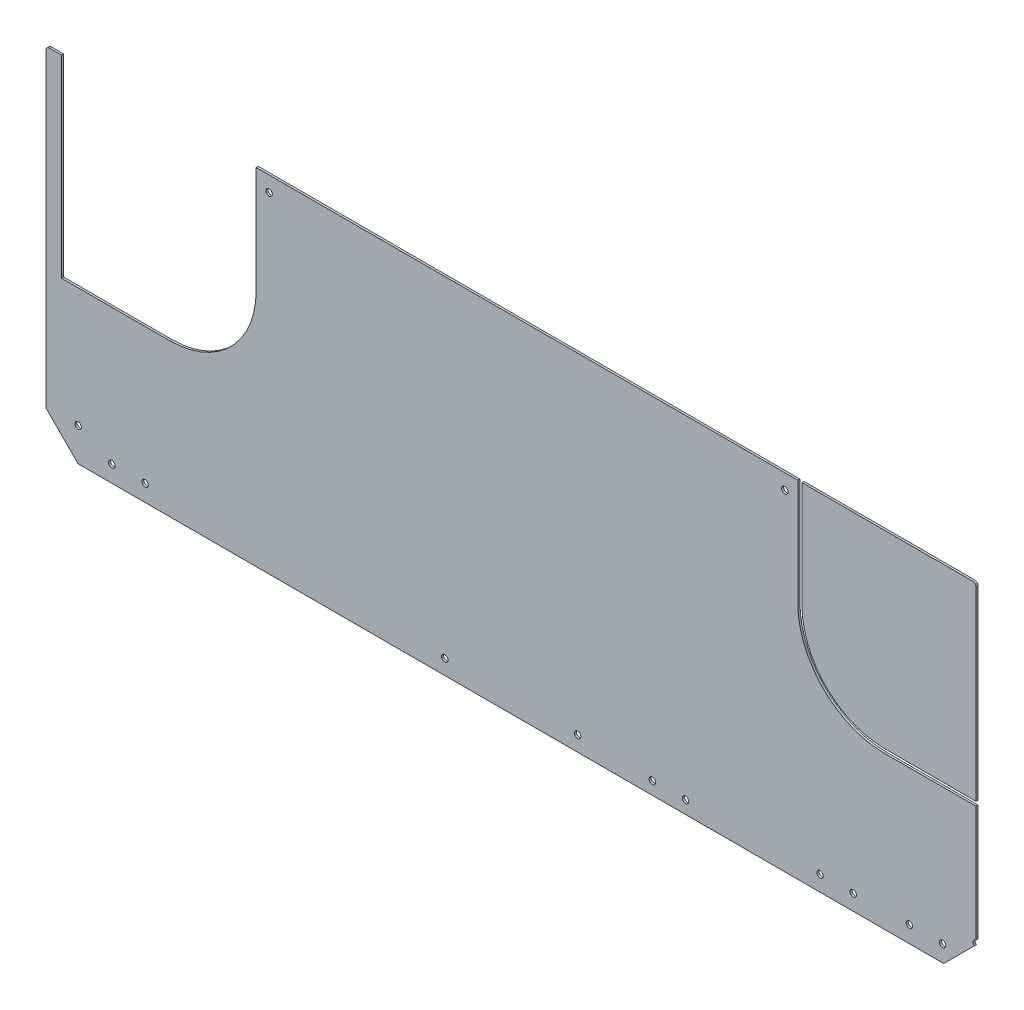
from build123d import *

# Parameters (mm, degrees)
SKETCH3_W                              = 914.4
SKETCH3_H                              = 609.6
BOSS_EXTRUDE1_DEPTH                    = 0.79375
SKETCH4_OUTSIDE_W                      = 1136.194
SKETCH4_OUTSIDE_H                      = 831.394
CUT_EXTRUDE1_DEPTH                     = 2.54
CUT_EXTRUDE2_DEPTH                     = 2.54
CUT_EXTRUDE3_DEPTH                     = 2.54
SKETCH11_W                             = 2.45745
SKETCH11_H                             = 1.5875
F_10_0_1935_DIAMETER_HOLE1_AT_2_COUNT  = 2
F_10_0_1935_DIAMETER_HOLE1_AT_2_PITCH  = 25.4
F_10_0_1935_DIAMETER_HOLE1_AT_3_COUNT  = 2
F_10_0_1935_DIAMETER_HOLE1_AT_3_PITCH  = 52.708494186
F_10_0_1935_DIAMETER_HOLE1_AT_4_COUNT  = 2
F_10_0_1935_DIAMETER_HOLE1_AT_4_PITCH  = 609.955600508
F_10_0_1935_DIAMETER_HOLE1_AT_5_COUNT  = 2
F_10_0_1935_DIAMETER_HOLE1_AT_5_PITCH  = 584.555600508
F_10_0_1935_DIAMETER_HOLE1_AT_6_COUNT  = 2
F_10_0_1935_DIAMETER_HOLE1_AT_6_PITCH  = 635.838045264
F_10_0_1935_DIAMETER_HOLE1_AT_7_COUNT  = 2
F_10_0_1935_DIAMETER_HOLE1_AT_7_PITCH  = 545.026051512
F_10_0_1935_DIAMETER_HOLE1_AT_8_COUNT  = 2
F_10_0_1935_DIAMETER_HOLE1_AT_8_PITCH  = 258.142956966
F_10_0_1935_DIAMETER_HOLE1_AT_9_COUNT  = 2
F_10_0_1935_DIAMETER_HOLE1_AT_9_PITCH  = 387.982235928
F_10_0_1935_DIAMETER_HOLE1_AT_10_COUNT = 2
F_10_0_1935_DIAMETER_HOLE1_AT_10_PITCH = 413.381201108
F_10_0_1935_DIAMETER_HOLE1_AT_11_COUNT = 2
F_10_0_1935_DIAMETER_HOLE1_AT_11_PITCH = 516.238100689
F_10_0_1935_DIAMETER_HOLE1_AT_12_COUNT = 2
F_10_0_1935_DIAMETER_HOLE1_AT_12_PITCH = 541.637973776
F_10_0_1935_DIAMETER_HOLE1_AT_13_COUNT = 2
F_10_0_1935_DIAMETER_HOLE1_AT_13_PITCH = 229.23100458
F_10_0_1935_DIAMETER_HOLE1_AT_14_COUNT = 2
F_10_0_1935_DIAMETER_HOLE1_AT_14_PITCH = 330.829132824


with BuildPart() as part:
    # Sketch3 → Boss-Extrude1 (new, symmetric)
    with BuildSketch(Plane.XY):
        Rectangle(SKETCH3_W, SKETCH3_H)
    extrude(amount=BOSS_EXTRUDE1_DEPTH, both=True)

    # Sketch4 outside → Cut-Extrude1 (cut)
    with BuildSketch(Plane.XY.offset(0.79375)):
        Rectangle(SKETCH4_OUTSIDE_W, SKETCH4_OUTSIDE_H)
        with BuildLine():
            Line((-364.741176915, -305.554584202), (-390.141176915, -280.154584202))
            Line((-390.141176915, -280.154584202), (-390.141176915, -42.982084202))
            ThreePointArc((-390.141176915, -42.982084202), (-389.397228139, -41.186032978), (-387.601176915, -40.442084202))
            Line((-387.601176915, -40.442084202), (318.518823085, -40.442084202))
            ThreePointArc((318.518823085, -40.442084202), (320.314874309, -41.186032978), (321.058823085, -42.982084202))
            Line((321.058823085, -42.982084202), (321.058823085, -280.154584202))
            Line((321.058823085, -280.154584202), (295.658823085, -305.554584202))
            Line((295.658823085, -305.554584202), (-364.741176915, -305.554584202))
        make_face(mode=Mode.SUBTRACT)
    extrude(amount=-CUT_EXTRUDE1_DEPTH, mode=Mode.SUBTRACT)

    # Sketch7 → Cut-Extrude2 (cut)
    with BuildSketch(Plane.XY.offset(0.79375)):
        with BuildLine():
            Line((-378.246738216, -188.190344021), (-378.246738216, -39.346344021))
            Line((-378.246738216, -39.346344021), (-229.402738216, -39.346344021))
            Line((-229.402738216, -39.346344021), (-229.402738216, -64.746344021))
            Line((-229.402738216, -64.746344021), (-229.402738216, -121.896344021))
            ThreePointArc((-229.402738216, -121.896344021), (-248.819801264, -168.773280973), (-295.696738216, -188.190344021))
            Line((-295.696738216, -188.190344021), (-352.846738216, -188.190344021))
            Line((-352.846738216, -188.190344021), (-378.246738216, -188.190344021))
        make_face()
    extrude(amount=-CUT_EXTRUDE2_DEPTH, mode=Mode.SUBTRACT)

    # Sketch8 → Cut-Extrude3 (cut)
    with BuildSketch(Plane.XY.offset(0.79375)):
        with BuildLine():
            Line((251.115061771, -188.190344021), (336.840061771, -188.190344021))
            Line((336.840061771, -188.190344021), (336.840061771, -36.171344021))
            Line((336.840061771, -36.171344021), (184.821061771, -36.171344021))
            Line((184.821061771, -36.171344021), (184.821061771, -121.896344021))
            ThreePointArc((184.821061771, -121.896344021), (204.238124819, -168.773280973), (251.115061771, -188.190344021))
        make_face()
        with BuildLine():
            Line((251.115061771, -185.015344021), (333.665061771, -185.015344021))
            Line((333.665061771, -185.015344021), (333.665061771, -39.346344021))
            Line((333.665061771, -39.346344021), (187.996061771, -39.346344021))
            Line((187.996061771, -39.346344021), (187.996061771, -121.896344021))
            ThreePointArc((187.996061771, -121.896344021), (206.483188849, -166.528216943), (251.115061771, -185.015344021))
        make_face(mode=Mode.SUBTRACT)
    extrude(amount=-CUT_EXTRUDE3_DEPTH, mode=Mode.SUBTRACT)


with BuildPart() as cut_extrude3_piece_1:
    # of the separate pieces the step leaves, piece 1, a body of its own (cut_extrude3_pieces)
    add(part.part.solids().sort_by_distance((296.413407287, -304.8, -0.79375))[0])

    # Sketch11 → #10 (0.1935) Diameter Hole1 (revolve, cut)
    with BuildSketch(Plane(origin=(-314.391138724, -292.114748821, 0.79375), x_dir=(0, -1, 0), z_dir=(1, 0, 0))):
        with Locations((1.228725, 0.79375)):
            Rectangle(SKETCH11_W, SKETCH11_H)
    f_10_0_1935_diameter_hole1 = revolve(axis=Axis((-314.391138724, -292.114748821, 7.14375), (0, 0, -1)), mode=Mode.SUBTRACT)

    # #10 (0.1935) Diameter Hole1 at 2: #10 (0.1935) Diameter Hole1 ×2
    with Locations(*[(-i * F_10_0_1935_DIAMETER_HOLE1_AT_2_PITCH, 0, 0) for i in range(1, F_10_0_1935_DIAMETER_HOLE1_AT_2_COUNT)]):
        add(f_10_0_1935_diameter_hole1, mode=Mode.SUBTRACT)

    # #10 (0.1935) Diameter Hole1 at 3: #10 (0.1935) Diameter Hole1 ×2
    with Locations(*[Vector(-0.9705380561850375, 0.2409478812867402, 0) * (i * F_10_0_1935_DIAMETER_HOLE1_AT_3_PITCH) for i in range(1, F_10_0_1935_DIAMETER_HOLE1_AT_3_COUNT)]):
        add(f_10_0_1935_diameter_hole1, mode=Mode.SUBTRACT)

    # #10 (0.1935) Diameter Hole1 at 4: #10 (0.1935) Diameter Hole1 ×2
    with Locations(*[(i * F_10_0_1935_DIAMETER_HOLE1_AT_4_PITCH, 0, 0) for i in range(1, F_10_0_1935_DIAMETER_HOLE1_AT_4_COUNT)]):
        add(f_10_0_1935_diameter_hole1, mode=Mode.SUBTRACT)

    # #10 (0.1935) Diameter Hole1 at 5: #10 (0.1935) Diameter Hole1 ×2
    with Locations(*[(i * F_10_0_1935_DIAMETER_HOLE1_AT_5_PITCH, 0, 0) for i in range(1, F_10_0_1935_DIAMETER_HOLE1_AT_5_COUNT)]):
        add(f_10_0_1935_diameter_hole1, mode=Mode.SUBTRACT)

    # #10 (0.1935) Diameter Hole1 at 6: #10 (0.1935) Diameter Hole1 ×2
    with Locations(*[Vector(0.9998005069605744, 0.01997363966277868, 0) * (i * F_10_0_1935_DIAMETER_HOLE1_AT_6_PITCH) for i in range(1, F_10_0_1935_DIAMETER_HOLE1_AT_6_COUNT)]):
        add(f_10_0_1935_diameter_hole1, mode=Mode.SUBTRACT)

    # #10 (0.1935) Diameter Hole1 at 7: #10 (0.1935) Diameter Hole1 ×2
    with Locations(*[Vector(0.8977666281056725, 0.44047143092347246, 0) * (i * F_10_0_1935_DIAMETER_HOLE1_AT_7_PITCH) for i in range(1, F_10_0_1935_DIAMETER_HOLE1_AT_7_COUNT)]):
        add(f_10_0_1935_diameter_hole1, mode=Mode.SUBTRACT)

    # #10 (0.1935) Diameter Hole1 at 8: #10 (0.1935) Diameter Hole1 ×2
    with Locations(*[Vector(0.3676040656829352, 0.929982392786754, 0) * (i * F_10_0_1935_DIAMETER_HOLE1_AT_8_PITCH) for i in range(1, F_10_0_1935_DIAMETER_HOLE1_AT_8_COUNT)]):
        add(f_10_0_1935_diameter_hole1, mode=Mode.SUBTRACT)

    # #10 (0.1935) Diameter Hole1 at 9: #10 (0.1935) Diameter Hole1 ×2
    with Locations(*[Vector(0.9999705397694504, -0.007675909926132699, 0) * (i * F_10_0_1935_DIAMETER_HOLE1_AT_9_PITCH) for i in range(1, F_10_0_1935_DIAMETER_HOLE1_AT_9_COUNT)]):
        add(f_10_0_1935_diameter_hole1, mode=Mode.SUBTRACT)

    # #10 (0.1935) Diameter Hole1 at 10: #10 (0.1935) Diameter Hole1 ×2
    with Locations(*[Vector(0.9999747703828846, -0.0071034215486100935, 0) * (i * F_10_0_1935_DIAMETER_HOLE1_AT_10_PITCH) for i in range(1, F_10_0_1935_DIAMETER_HOLE1_AT_10_COUNT)]):
        add(f_10_0_1935_diameter_hole1, mode=Mode.SUBTRACT)

    # #10 (0.1935) Diameter Hole1 at 11: #10 (0.1935) Diameter Hole1 ×2
    with Locations(*[Vector(0.9999987256648789, -0.0015964550160305706, 0) * (i * F_10_0_1935_DIAMETER_HOLE1_AT_11_PITCH) for i in range(1, F_10_0_1935_DIAMETER_HOLE1_AT_11_COUNT)]):
        add(f_10_0_1935_diameter_hole1, mode=Mode.SUBTRACT)

    # #10 (0.1935) Diameter Hole1 at 12: #10 (0.1935) Diameter Hole1 ×2
    with Locations(*[Vector(0.9999989565517423, -0.0014446090913347437, 0) * (i * F_10_0_1935_DIAMETER_HOLE1_AT_12_PITCH) for i in range(1, F_10_0_1935_DIAMETER_HOLE1_AT_12_COUNT)]):
        add(f_10_0_1935_diameter_hole1, mode=Mode.SUBTRACT)

    # #10 (0.1935) Diameter Hole1 at 13: #10 (0.1935) Diameter Hole1 ×2
    with Locations(*[Vector(0.9999840351163782, -0.005650620529293304, 0) * (i * F_10_0_1935_DIAMETER_HOLE1_AT_13_PITCH) for i in range(1, F_10_0_1935_DIAMETER_HOLE1_AT_13_COUNT)]):
        add(f_10_0_1935_diameter_hole1, mode=Mode.SUBTRACT)

    # #10 (0.1935) Diameter Hole1 at 14: #10 (0.1935) Diameter Hole1 ×2
    with Locations(*[Vector(0.9999941819431991, -0.003411169850958024, 0) * (i * F_10_0_1935_DIAMETER_HOLE1_AT_14_PITCH) for i in range(1, F_10_0_1935_DIAMETER_HOLE1_AT_14_COUNT)]):
        add(f_10_0_1935_diameter_hole1, mode=Mode.SUBTRACT)


with BuildPart() as cut_extrude3_piece_2:
    # of the separate pieces the step leaves, piece 2, a body of its own (cut_extrude3_pieces)
    add(part.part.solids().sort_by_distance((321.058823085, -42.982084202, 0.79375))[0])


solid = Compound([cut_extrude3_piece_1.part, cut_extrude3_piece_2.part])
